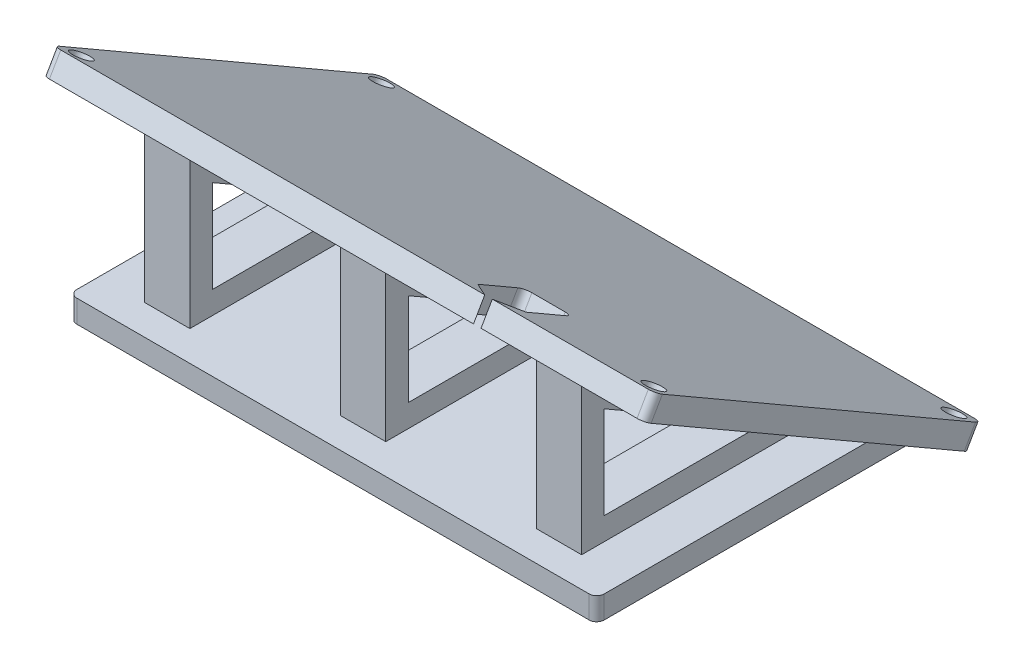
from build123d import *

# Parameters (mm, degrees)
SKETCH8_W           = 70
SKETCH8_H           = 36
BOSS_EXTRUDE3_DEPTH = 3
SKETCH9_W           = 6
SKETCH9_H           = 32
BOSS_EXTRUDE4_DEPTH = 20.47521
CUT_EXTRUDE1_DEPTH  = 100
BOSS_EXTRUDE5_DEPTH = 3
BOSS_EXTRUDE6_DEPTH = 70
SKETCH15_R          = 1.3
CUT_EXTRUDE2_DEPTH  = 3
CUT_EXTRUDE3_DEPTH  = 100
SKETCH17_W          = 62
SKETCH17_H          = 10
CUT_EXTRUDE4_DEPTH  = 1
FILLET1_R           = 1
CUT_EXTRUDE5_DEPTH  = 10


with BuildPart() as part:
    # Sketch8 → Boss-Extrude3 (new body)
    with BuildSketch(Plane(origin=(0, 0, 0), x_dir=(1, 0, 0), z_dir=(0, 1, 0))):
        with Locations((35, 18)):
            Rectangle(SKETCH8_W, SKETCH8_H)
    extrude(amount=BOSS_EXTRUDE3_DEPTH)

    # Sketch9 → Boss-Extrude4 (add)
    with BuildSketch(Plane(origin=(0, 3, 0), x_dir=(1, 0, 0), z_dir=(0, 1, 0))):
        with Locations((61, 20)):
            Rectangle(SKETCH9_W, SKETCH9_H)
        with Locations((9, 20)):
            Rectangle(SKETCH9_W, SKETCH9_H)
        with Locations((35, 20)):
            Rectangle(SKETCH9_W, SKETCH9_H)
    extrude(amount=BOSS_EXTRUDE4_DEPTH)

    # Sketch10 → Cut-Extrude1 (cut)
    with BuildSketch(Plane.ZY.offset(-6)):
        Polygon((-36, 5), (-4, 23.47521), (-36, 23.47521), align=None)
    extrude(amount=-CUT_EXTRUDE1_DEPTH, mode=Mode.SUBTRACT)

    # Sketch11 → Boss-Extrude5 (add)
    with BuildSketch(Plane(origin=(0, 19.338457712, -11.165064603), x_dir=(1, 0, 0), z_dir=(0, 0.8660253875430481, -0.5000000281309126))):
        Polygon((6, 38.676913811), (-5, 38.676913811), (-5, -11.323086189), (75, -11.323086189), (75, 38.676913811), (64, 38.676913811), align=None)
    extrude(amount=BOSS_EXTRUDE5_DEPTH)

    # Sketch14 → Boss-Extrude6 (add)
    with BuildSketch(Plane.ZY):
        Polygon((-36, 0), (-44.660253875, -2.81e-07), (-36, 5), align=None)
    extrude(amount=-BOSS_EXTRUDE6_DEPTH)

    # Sketch15 → Cut-Extrude2 (cut)
    with BuildSketch(Plane(origin=(0, 21.936533875, -12.665064688), x_dir=(1, 0, 0), z_dir=(0, 0.8660253875430481, -0.5000000281309125))):
        with Locations(Location((-3, 36.676913811, 0), (0, 0, 270))):
            Circle(SKETCH15_R)
        with Locations(Location((73, 36.676913811, 0), (0, 0, 90))):
            Circle(SKETCH15_R)
        with Locations(Location((73, -9.323086189, 0), (0, 0, 270))):
            Circle(SKETCH15_R)
        with Locations(Location((-3, -9.323086189, 0), (0, 0, 90))):
            Circle(SKETCH15_R)
    extrude(amount=-CUT_EXTRUDE2_DEPTH, mode=Mode.SUBTRACT)

    # Sketch16 → Cut-Extrude3 (cut)
    with BuildSketch(Plane.ZY.offset(-6)):
        Polygon((-7, 6), (-7, 18.279057382), (-28.26794966, 6), align=None)
    extrude(amount=-CUT_EXTRUDE3_DEPTH, mode=Mode.SUBTRACT)

    # Sketch17 → Cut-Extrude4 (cut)
    with BuildSketch(Plane.XZ):
        with Locations((35, -7)):
            Rectangle(SKETCH17_W, SKETCH17_H)
        with Locations((35, -37.660253875)):
            Rectangle(SKETCH17_W, SKETCH17_H)
    extrude(amount=-CUT_EXTRUDE4_DEPTH, mode=Mode.SUBTRACT)

    # Fillet1
    fillet1_edges = [part.edges().sort_by_distance(p)[0] for p in [
        (70, 1.5, 0),
        (0, 1.5, 0),
        (-5, 1.2990378, -45.410253918),
        (-5, 26.299039207, -2.10898454),
        (75, 26.299039207, -2.10898454),
        (75, 1.2990378, -45.410253918),
    ]]
    fillet(fillet1_edges, radius=FILLET1_R)

    # Sketch18 → Cut-Extrude5 (cut)
    with BuildSketch(Plane(origin=(0, 19.338457712, -11.165064603), x_dir=(1, 0, 0), z_dir=(0, -0.8660253875430481, 0.5000000281309125))):
        with BuildLine():
            Line((49.57742676, 6.27350411), (49.57742676, 9.27350411))
            Line((49.57742676, 9.27350411), (52.28871338, 11.323086189))
            Line((52.28871338, 11.323086189), (53.28871338, 11.323086189))
            Line((53.28871338, 11.323086189), (56, 9.27350411))
            Line((56, 9.27350411), (56, 6.27350411))
            Line((56, 6.27350411), (56, 3.12980455))
            ThreePointArc((56, 3.12980455), (55.707106781, 2.422697769), (55, 2.12980455))
            Line((55, 2.12980455), (50.57742676, 2.12980455))
            ThreePointArc((50.57742676, 2.12980455), (49.870319979, 2.422697769), (49.57742676, 3.12980455))
            Line((49.57742676, 3.12980455), (49.57742676, 6.27350411))
        make_face()
    extrude(amount=-CUT_EXTRUDE5_DEPTH, mode=Mode.SUBTRACT)


solid = part.part
